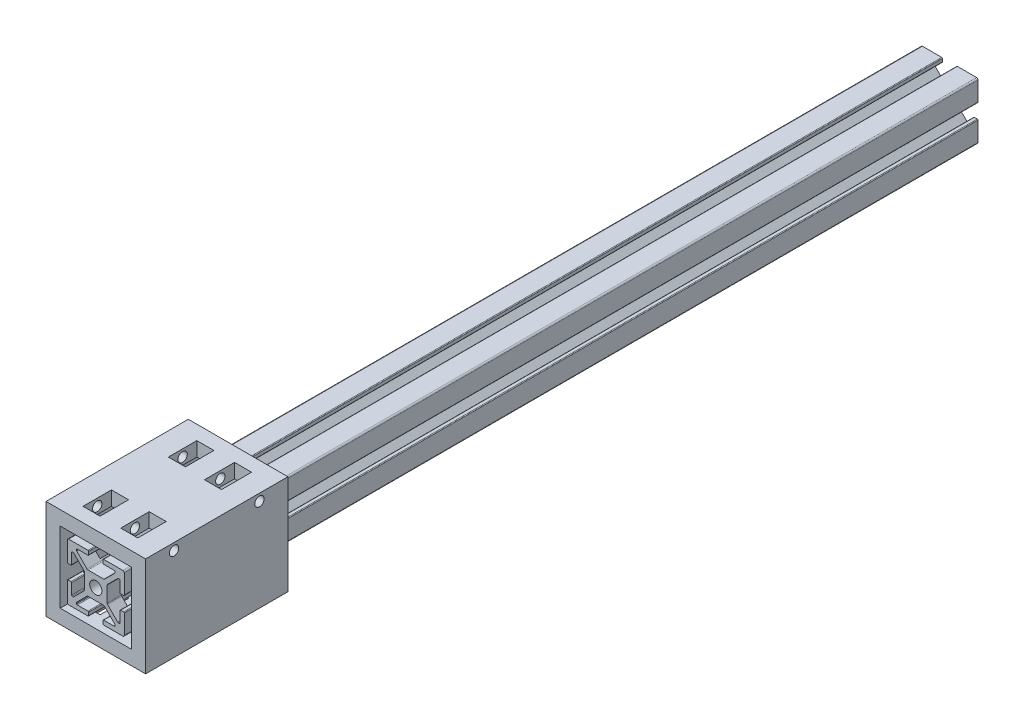
from build123d import *

# Parameters (mm, degrees)
SKETCH_1_R               = 2.15
EXTRUDE_1_DEPTH          = 300
SKETCH_2_W               = 35
SKETCH_2_H               = 35
SKETCH_2_W_2             = 25
SKETCH_2_H_2             = 25
EXTRUDE_2_DEPTH          = 50
SKETCH_3_W               = 6
SKETCH_3_H               = 10
SKETCH_3_H_2             = 10.567573568
CUT_EXTRUDE_1_DEPTH      = 303.541319492
CUT_EXTRUDE_2_DEPTH      = 302.242842239
CUT_EXTRUDE_2_DEPTH_BACK = 302.242842239
SKETCH_4_R               = 1.65


with BuildPart() as part:
    # Эскиз1 → Бобышка-Вытянуть1 (new body)
    with BuildSketch(Plane.XY):
        with BuildLine():
            Line((-10, -2.75), (-10, -9.5))
            ThreePointArc((-10, -9.5), (-9.853553391, -9.853553391), (-9.5, -10))
            Line((-9.5, -10), (-2.75, -10))
            ThreePointArc((-2.75, -10), (-2.573223305, -9.926776695), (-2.5, -9.75))
            Line((-2.5, -9.75), (-2.5, -8.75))
            ThreePointArc((-2.5, -8.75), (-2.573223305, -8.573223305), (-2.75, -8.5))
            Line((-2.75, -8.5), (-6.5, -8.5))
            ThreePointArc((-6.5, -8.5), (-6.676776695, -8.426776695), (-6.75, -8.25))
            Line((-6.75, -8.25), (-6.75, -7.914213562))
            ThreePointArc((-6.75, -7.914213562), (-6.730969883, -7.818542704), (-6.676776695, -7.737436867))
            Line((-6.676776695, -7.737436867), (-3.085786438, -4.146446609))
            ThreePointArc((-3.085786438, -4.146446609), (-2.923574763, -4.038060234), (-2.732233047, -4))
            Line((-2.732233047, -4), (2.732233047, -4))
            ThreePointArc((2.732233047, -4), (2.923574763, -4.038060234), (3.085786438, -4.146446609))
            Line((3.085786438, -4.146446609), (6.676776695, -7.737436867))
            ThreePointArc((6.676776695, -7.737436867), (6.730969883, -7.818542704), (6.75, -7.914213562))
            Line((6.75, -7.914213562), (6.75, -8.25))
            ThreePointArc((6.75, -8.25), (6.676776695, -8.426776695), (6.5, -8.5))
            Line((6.5, -8.5), (2.75, -8.5))
            ThreePointArc((2.75, -8.5), (2.573223305, -8.573223305), (2.5, -8.75))
            Line((2.5, -8.75), (2.5, -9.75))
            ThreePointArc((2.5, -9.75), (2.573223305, -9.926776695), (2.75, -10))
            Line((2.75, -10), (9.5, -10))
            ThreePointArc((9.5, -10), (9.853553391, -9.853553391), (10, -9.5))
            Line((10, -9.5), (10, -2.75))
            ThreePointArc((10, -2.75), (9.926776695, -2.573223305), (9.75, -2.5))
            Line((9.75, -2.5), (8.75, -2.5))
            ThreePointArc((8.75, -2.5), (8.573223305, -2.573223305), (8.5, -2.75))
            Line((8.5, -2.75), (8.5, -6.5))
            ThreePointArc((8.5, -6.5), (8.426776695, -6.676776695), (8.25, -6.75))
            Line((8.25, -6.75), (7.914213562, -6.75))
            ThreePointArc((7.914213562, -6.75), (7.818542704, -6.730969883), (7.737436867, -6.676776695))
            Line((7.737436867, -6.676776695), (4.146446609, -3.085786438))
            ThreePointArc((4.146446609, -3.085786438), (4.038060234, -2.923574763), (4, -2.732233047))
            Line((4, -2.732233047), (4, 2.732233047))
            ThreePointArc((4, 2.732233047), (4.038060234, 2.923574763), (4.146446609, 3.085786438))
            Line((4.146446609, 3.085786438), (7.737436867, 6.676776695))
            ThreePointArc((7.737436867, 6.676776695), (7.818542704, 6.730969883), (7.914213562, 6.75))
            Line((7.914213562, 6.75), (8.25, 6.75))
            ThreePointArc((8.25, 6.75), (8.426776695, 6.676776695), (8.5, 6.5))
            Line((8.5, 6.5), (8.5, 2.75))
            ThreePointArc((8.5, 2.75), (8.573223305, 2.573223305), (8.75, 2.5))
            Line((8.75, 2.5), (9.75, 2.5))
            ThreePointArc((9.75, 2.5), (9.926776695, 2.573223305), (10, 2.75))
            Line((10, 2.75), (10, 9.5))
            ThreePointArc((10, 9.5), (9.853553391, 9.853553391), (9.5, 10))
            Line((9.5, 10), (2.75, 10))
            ThreePointArc((2.75, 10), (2.573223305, 9.926776695), (2.5, 9.75))
            Line((2.5, 9.75), (2.5, 8.75))
            ThreePointArc((2.5, 8.75), (2.573223305, 8.573223305), (2.75, 8.5))
            Line((2.75, 8.5), (6.5, 8.5))
            ThreePointArc((6.5, 8.5), (6.676776695, 8.426776695), (6.75, 8.25))
            Line((6.75, 8.25), (6.75, 7.810660172))
            Line((6.75, 7.810660172), (3.012563133, 4.073223305))
            ThreePointArc((3.012563133, 4.073223305), (2.931457296, 4.019030117), (2.835786438, 4))
            Line((2.835786438, 4), (-2.732233047, 4))
            ThreePointArc((-2.732233047, 4), (-2.923574763, 4.038060234), (-3.085786438, 4.146446609))
            Line((-3.085786438, 4.146446609), (-6.676776695, 7.737436867))
            ThreePointArc((-6.676776695, 7.737436867), (-6.730969883, 7.818542704), (-6.75, 7.914213562))
            Line((-6.75, 7.914213562), (-6.75, 8.25))
            ThreePointArc((-6.75, 8.25), (-6.676776695, 8.426776695), (-6.5, 8.5))
            Line((-6.5, 8.5), (-2.75, 8.5))
            ThreePointArc((-2.75, 8.5), (-2.573223305, 8.573223305), (-2.5, 8.75))
            Line((-2.5, 8.75), (-2.5, 9.75))
            ThreePointArc((-2.5, 9.75), (-2.573223305, 9.926776695), (-2.75, 10))
            Line((-2.75, 10), (-9.5, 10))
            ThreePointArc((-9.5, 10), (-9.853553391, 9.853553391), (-10, 9.5))
            Line((-10, 9.5), (-10, 2.75))
            ThreePointArc((-10, 2.75), (-9.926776695, 2.573223305), (-9.75, 2.5))
            Line((-9.75, 2.5), (-8.75, 2.5))
            ThreePointArc((-8.75, 2.5), (-8.573223305, 2.573223305), (-8.5, 2.75))
            Line((-8.5, 2.75), (-8.5, 6.5))
            ThreePointArc((-8.5, 6.5), (-8.426776695, 6.676776695), (-8.25, 6.75))
            Line((-8.25, 6.75), (-7.914213562, 6.75))
            ThreePointArc((-7.914213562, 6.75), (-7.818542704, 6.730969883), (-7.737436867, 6.676776695))
            Line((-7.737436867, 6.676776695), (-4.146446609, 3.085786438))
            ThreePointArc((-4.146446609, 3.085786438), (-4.038060234, 2.923574763), (-4, 2.732233047))
            Line((-4, 2.732233047), (-4, -2.732233047))
            ThreePointArc((-4, -2.732233047), (-4.038060234, -2.923574763), (-4.146446609, -3.085786438))
            Line((-4.146446609, -3.085786438), (-7.737436867, -6.676776695))
            ThreePointArc((-7.737436867, -6.676776695), (-7.818542704, -6.730969883), (-7.914213562, -6.75))
            Line((-7.914213562, -6.75), (-8.25, -6.75))
            ThreePointArc((-8.25, -6.75), (-8.426776695, -6.676776695), (-8.5, -6.5))
            Line((-8.5, -6.5), (-8.5, -2.75))
            ThreePointArc((-8.5, -2.75), (-8.573223305, -2.573223305), (-8.75, -2.5))
            Line((-8.75, -2.5), (-9.75, -2.5))
            ThreePointArc((-9.75, -2.5), (-9.926776695, -2.573223305), (-10, -2.75))
        make_face()
        with Locations(Location((0, 0, 0), (0, 0, 180))):
            Circle(SKETCH_1_R, mode=Mode.SUBTRACT)
    extrude(amount=-EXTRUDE_1_DEPTH)


with BuildPart() as body_2:
    # Эскиз2 → Бобышка-Вытянуть2 (new body)
    with BuildSketch(Plane.XY):
        Rectangle(SKETCH_2_W, SKETCH_2_H)
        Rectangle(SKETCH_2_W_2, SKETCH_2_H_2, mode=Mode.SUBTRACT)
    extrude(amount=-EXTRUDE_2_DEPTH)


with BuildPart() as cut_extrude_1_tool:
    # Эскиз3 → Вырез-Вытянуть1 (new, through all)
    with BuildSketch(Plane.XZ.offset(17.5)):
        with Locations((-6.5, -10)):
            Rectangle(SKETCH_3_W, SKETCH_3_H)
        with Locations((6.75, -10)):
            Rectangle(SKETCH_3_W, SKETCH_3_H)
        with Locations((-6.5, -40)):
            Rectangle(SKETCH_3_W, SKETCH_3_H)
        with Locations((6.75, -39.716213216)):
            Rectangle(SKETCH_3_W, SKETCH_3_H_2)
    extrude(amount=-CUT_EXTRUDE_1_DEPTH)


with BuildPart() as part_1:
    add(part.part)

    # Вырез-Вытянуть1: cut by cut_extrude_1_tool
    add(cut_extrude_1_tool.part, mode=Mode.SUBTRACT)


with BuildPart() as body_2_1:
    add(body_2.part)

    # Вырез-Вытянуть1: cut by cut_extrude_1_tool
    add(cut_extrude_1_tool.part, mode=Mode.SUBTRACT)

    # Эскиз4 → Вырез-Вытянуть2 (cut, two sides: drawn at the far end of the back side and taken through both)
    with BuildSketch(Plane.ZY.offset(3.5).offset(-CUT_EXTRUDE_2_DEPTH_BACK)):
        with Locations((-10, 15)):
            Circle(SKETCH_4_R)
        with Locations((-40, 15)):
            Circle(SKETCH_4_R)
    extrude(amount=CUT_EXTRUDE_2_DEPTH + CUT_EXTRUDE_2_DEPTH_BACK, mode=Mode.SUBTRACT)


solid = Compound([part_1.part, body_2_1.part])
